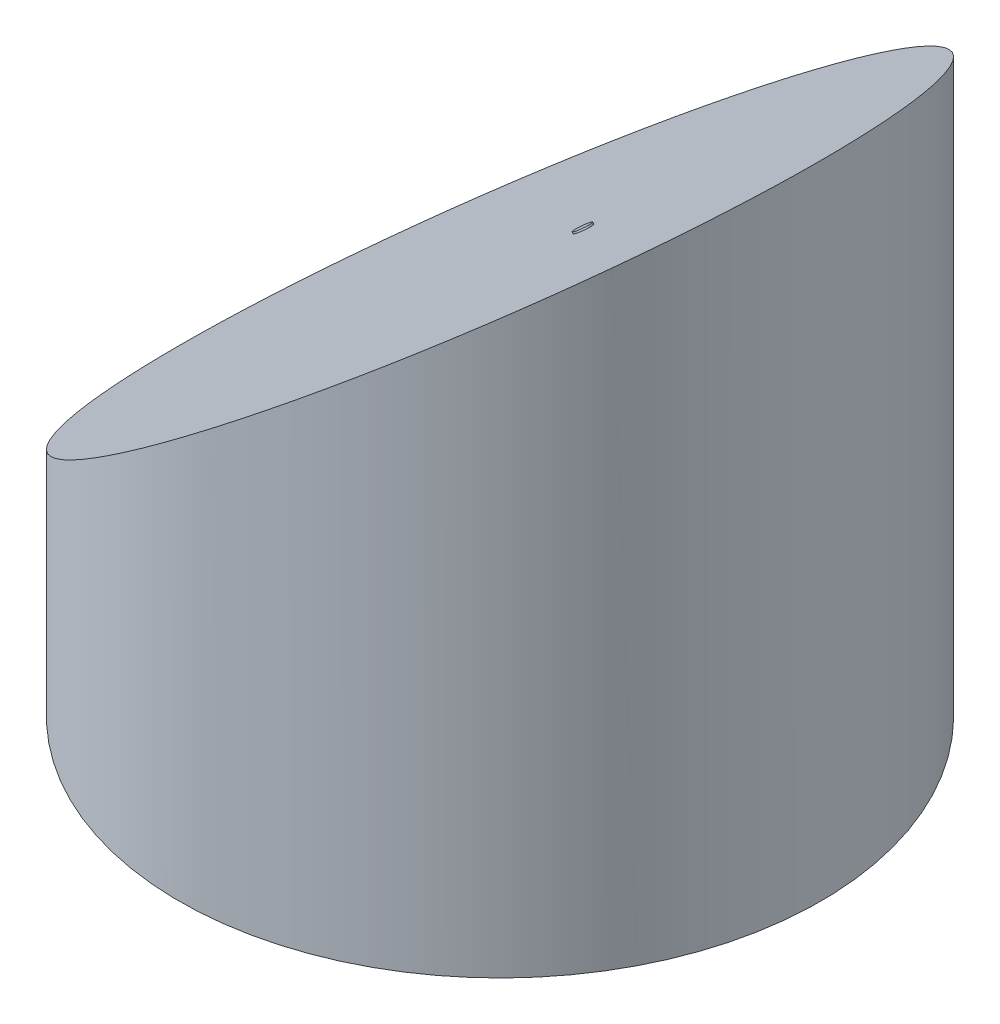
from build123d import *

# Parameters (mm, degrees)
SKETCH1_W               = 2000
SKETCH1_H               = 4000
CUT_EXTRUDE1_DEPTH      = 4124.105625618
CUT_EXTRUDE1_DEPTH_BACK = 4124.105625618
SKETCH3_R               = 50
BOSS_EXTRUDE1_DEPTH     = 10


with BuildPart() as part:
    # Sketch1 → Revolve1 (revolve)
    with BuildSketch(Plane.XY):
        with Locations((-1000, 1000)):
            Rectangle(SKETCH1_W, SKETCH1_H)
    revolve(axis=Axis((0, 3000, 0), (0, -1, 0)))

    # Sketch2 → Cut-Extrude1 (cut, two sides: drawn at the far end of the back side and taken through both)
    with BuildSketch(Plane.XY.offset(-CUT_EXTRUDE1_DEPTH_BACK)):
        Polygon((2000, 3000), (-2000, 3000), (-2000, 1.079525824), align=None)
    extrude(amount=CUT_EXTRUDE1_DEPTH + CUT_EXTRUDE1_DEPTH_BACK, mode=Mode.SUBTRACT)

    # Sketch3 → Boss-Extrude1 (add)
    with BuildSketch(Plane(origin=(-720.186463571, 960.594280205, 0), x_dir=(0.8001036359678502, 0.5998617938417364, 0), z_dir=(-0.5998617938417364, 0.8001036359678502, 0))):
        with Locations((1550.440294361, 0)):
            Circle(SKETCH3_R)
    extrude(amount=BOSS_EXTRUDE1_DEPTH)


solid = part.part
